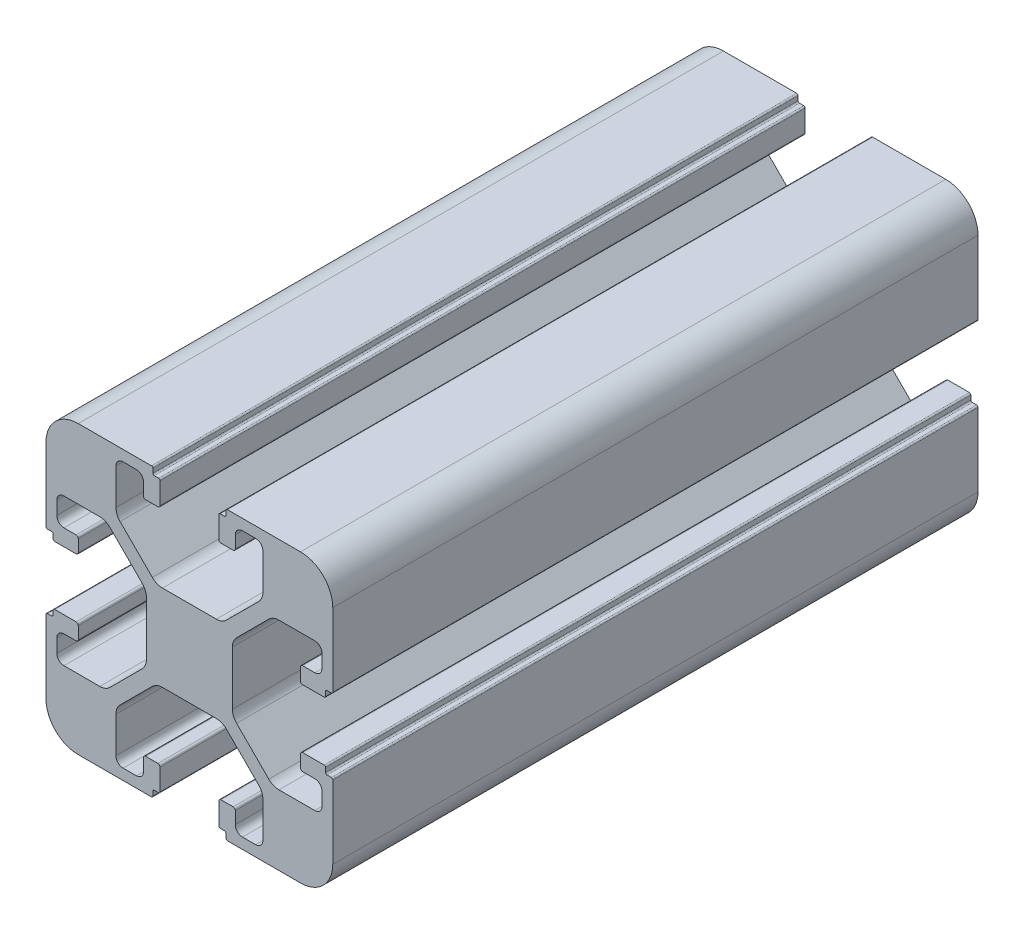
from build123d import *

# Parameters (mm, degrees)
SKETCH2_R           = 3.4
BOSS_EXTRUDE1_DEPTH = 50
BOSS_EXTRUDE2_DEPTH = 40


with BuildPart() as part:
    # Sketch2 → Boss-Extrude1 (new body)
    with BuildSketch(Plane.XY):
        with BuildLine():
            Line((4.5, 0), (14.7, 0))
            ThreePointArc((14.7, 0), (14.841421356, 0.058578644), (14.9, 0.2))
            Line((14.9, 0.2), (14.9, 0.8))
            ThreePointArc((14.9, 0.8), (14.958578644, 0.941421356), (15.1, 1))
            Line((15.1, 1), (15.7, 1))
            ThreePointArc((15.7, 1), (15.841421356, 1.058578644), (15.9, 1.2))
            Line((15.9, 1.2), (15.9, 4.2))
            ThreePointArc((15.9, 4.2), (15.812132034, 4.412132034), (15.6, 4.5))
            Line((15.6, 4.5), (13.9, 4.5))
            ThreePointArc((13.9, 4.5), (13.687867966, 4.412132034), (13.6, 4.2))
            Line((13.6, 4.2), (13.6, 2.5))
            ThreePointArc((13.6, 2.5), (13.307106781, 1.792893219), (12.6, 1.5))
            Line((12.6, 1.5), (10.75, 1.5))
            ThreePointArc((10.75, 1.5), (10.042893219, 1.792893219), (9.75, 2.5))
            Line((9.75, 2.5), (9.75, 7.507359313))
            ThreePointArc((9.75, 7.507359313), (9.902240935, 8.272726178), (10.335786438, 8.921572875))
            Line((10.335786438, 8.921572875), (14.828427125, 13.414213562))
            ThreePointArc((14.828427125, 13.414213562), (15.477273822, 13.847759065), (16.242640687, 14))
            Line((16.242640687, 14), (23.757359313, 14))
            ThreePointArc((23.757359313, 14), (24.522726178, 13.847759065), (25.171572875, 13.414213562))
            Line((25.171572875, 13.414213562), (29.664213562, 8.921572875))
            ThreePointArc((29.664213562, 8.921572875), (30.097759065, 8.272726178), (30.25, 7.507359313))
            Line((30.25, 7.507359313), (30.25, 2.5))
            ThreePointArc((30.25, 2.5), (29.957106781, 1.792893219), (29.25, 1.5))
            Line((29.25, 1.5), (27.4, 1.5))
            ThreePointArc((27.4, 1.5), (26.692893219, 1.792893219), (26.4, 2.5))
            Line((26.4, 2.5), (26.4, 4.2))
            ThreePointArc((26.4, 4.2), (26.312132034, 4.412132034), (26.1, 4.5))
            Line((26.1, 4.5), (24.4, 4.5))
            ThreePointArc((24.4, 4.5), (24.187867966, 4.412132034), (24.1, 4.2))
            Line((24.1, 4.2), (24.1, 1.2))
            ThreePointArc((24.1, 1.2), (24.158578644, 1.058578644), (24.3, 1))
            Line((24.3, 1), (24.9, 1))
            ThreePointArc((24.9, 1), (25.041421356, 0.941421356), (25.1, 0.8))
            Line((25.1, 0.8), (25.1, 0.2))
            ThreePointArc((25.1, 0.2), (25.158578644, 0.058578644), (25.3, 0))
            Line((25.3, 0), (35.5, 0))
            ThreePointArc((35.5, 0), (38.681980515, 1.318019485), (40, 4.5))
            Line((40, 4.5), (40, 14.7))
            ThreePointArc((40, 14.7), (39.941421356, 14.841421356), (39.8, 14.9))
            Line((39.8, 14.9), (39.2, 14.9))
            ThreePointArc((39.2, 14.9), (39.058578644, 14.958578644), (39, 15.1))
            Line((39, 15.1), (39, 15.7))
            ThreePointArc((39, 15.7), (38.941421356, 15.841421356), (38.8, 15.9))
            Line((38.8, 15.9), (35.8, 15.9))
            ThreePointArc((35.8, 15.9), (35.587867966, 15.812132034), (35.5, 15.6))
            Line((35.5, 15.6), (35.5, 13.9))
            ThreePointArc((35.5, 13.9), (35.587867966, 13.687867966), (35.8, 13.6))
            Line((35.8, 13.6), (37.5, 13.6))
            ThreePointArc((37.5, 13.6), (38.207106781, 13.307106781), (38.5, 12.6))
            Line((38.5, 12.6), (38.5, 10.75))
            ThreePointArc((38.5, 10.75), (38.207106781, 10.042893219), (37.5, 9.75))
            Line((37.5, 9.75), (32.492640687, 9.75))
            ThreePointArc((32.492640687, 9.75), (31.727273822, 9.902240935), (31.078427125, 10.335786438))
            Line((31.078427125, 10.335786438), (26.585786438, 14.828427125))
            ThreePointArc((26.585786438, 14.828427125), (26.152240935, 15.477273822), (26, 16.242640687))
            Line((26, 16.242640687), (26, 23.757359313))
            ThreePointArc((26, 23.757359313), (26.152240935, 24.522726178), (26.585786438, 25.171572875))
            Line((26.585786438, 25.171572875), (31.078427125, 29.664213562))
            ThreePointArc((31.078427125, 29.664213562), (31.727273822, 30.097759065), (32.492640687, 30.25))
            Line((32.492640687, 30.25), (37.5, 30.25))
            ThreePointArc((37.5, 30.25), (38.207106781, 29.957106781), (38.5, 29.25))
            Line((38.5, 29.25), (38.5, 27.4))
            ThreePointArc((38.5, 27.4), (38.207106781, 26.692893219), (37.5, 26.4))
            Line((37.5, 26.4), (35.8, 26.4))
            ThreePointArc((35.8, 26.4), (35.587867966, 26.312132034), (35.5, 26.1))
            Line((35.5, 26.1), (35.5, 24.4))
            ThreePointArc((35.5, 24.4), (35.587867966, 24.187867966), (35.8, 24.1))
            Line((35.8, 24.1), (38.8, 24.1))
            ThreePointArc((38.8, 24.1), (38.941421356, 24.158578644), (39, 24.3))
            Line((39, 24.3), (39, 24.9))
            ThreePointArc((39, 24.9), (39.058578644, 25.041421356), (39.2, 25.1))
            Line((39.2, 25.1), (39.8, 25.1))
            ThreePointArc((39.8, 25.1), (39.941421356, 25.158578644), (40, 25.3))
            Line((40, 25.3), (40, 35.5))
            ThreePointArc((40, 35.5), (38.681980515, 38.681980515), (35.5, 40))
            Line((35.5, 40), (25.3, 40))
            ThreePointArc((25.3, 40), (25.158578644, 39.941421356), (25.1, 39.8))
            Line((25.1, 39.8), (25.1, 39.2))
            ThreePointArc((25.1, 39.2), (25.041421356, 39.058578644), (24.9, 39))
            Line((24.9, 39), (24.3, 39))
            ThreePointArc((24.3, 39), (24.158578644, 38.941421356), (24.1, 38.8))
            Line((24.1, 38.8), (24.1, 35.8))
            ThreePointArc((24.1, 35.8), (24.187867966, 35.587867966), (24.4, 35.5))
            Line((24.4, 35.5), (26.1, 35.5))
            ThreePointArc((26.1, 35.5), (26.312132034, 35.587867966), (26.4, 35.8))
            Line((26.4, 35.8), (26.4, 37.5))
            ThreePointArc((26.4, 37.5), (26.692893219, 38.207106781), (27.4, 38.5))
            Line((27.4, 38.5), (29.25, 38.5))
            ThreePointArc((29.25, 38.5), (29.957106781, 38.207106781), (30.25, 37.5))
            Line((30.25, 37.5), (30.25, 32.492640687))
            ThreePointArc((30.25, 32.492640687), (30.097759065, 31.727273822), (29.664213562, 31.078427125))
            Line((29.664213562, 31.078427125), (25.171572875, 26.585786438))
            ThreePointArc((25.171572875, 26.585786438), (24.522726178, 26.152240935), (23.757359313, 26))
            Line((23.757359313, 26), (16.242640687, 26))
            ThreePointArc((16.242640687, 26), (15.477273822, 26.152240935), (14.828427125, 26.585786438))
            Line((14.828427125, 26.585786438), (10.335786438, 31.078427125))
            ThreePointArc((10.335786438, 31.078427125), (9.902240935, 31.727273822), (9.75, 32.492640687))
            Line((9.75, 32.492640687), (9.75, 37.5))
            ThreePointArc((9.75, 37.5), (10.042893219, 38.207106781), (10.75, 38.5))
            Line((10.75, 38.5), (12.6, 38.5))
            ThreePointArc((12.6, 38.5), (13.307106781, 38.207106781), (13.6, 37.5))
            Line((13.6, 37.5), (13.6, 35.8))
            ThreePointArc((13.6, 35.8), (13.687867966, 35.587867966), (13.9, 35.5))
            Line((13.9, 35.5), (15.6, 35.5))
            ThreePointArc((15.6, 35.5), (15.812132034, 35.587867966), (15.9, 35.8))
            Line((15.9, 35.8), (15.9, 38.8))
            ThreePointArc((15.9, 38.8), (15.841421356, 38.941421356), (15.7, 39))
            Line((15.7, 39), (15.1, 39))
            ThreePointArc((15.1, 39), (14.958578644, 39.058578644), (14.9, 39.2))
            Line((14.9, 39.2), (14.9, 39.8))
            ThreePointArc((14.9, 39.8), (14.841421356, 39.941421356), (14.7, 40))
            Line((14.7, 40), (4.5, 40))
            ThreePointArc((4.5, 40), (1.318019485, 38.681980515), (0, 35.5))
            Line((0, 35.5), (0, 25.3))
            ThreePointArc((0, 25.3), (0.058578644, 25.158578644), (0.2, 25.1))
            Line((0.2, 25.1), (0.8, 25.1))
            ThreePointArc((0.8, 25.1), (0.941421356, 25.041421356), (1, 24.9))
            Line((1, 24.9), (1, 24.3))
            ThreePointArc((1, 24.3), (1.058578644, 24.158578644), (1.2, 24.1))
            Line((1.2, 24.1), (4.2, 24.1))
            ThreePointArc((4.2, 24.1), (4.412132034, 24.187867966), (4.5, 24.4))
            Line((4.5, 24.4), (4.5, 26.1))
            ThreePointArc((4.5, 26.1), (4.412132034, 26.312132034), (4.2, 26.4))
            Line((4.2, 26.4), (2.5, 26.4))
            ThreePointArc((2.5, 26.4), (1.792893219, 26.692893219), (1.5, 27.4))
            Line((1.5, 27.4), (1.5, 29.25))
            ThreePointArc((1.5, 29.25), (1.792893219, 29.957106781), (2.5, 30.25))
            Line((2.5, 30.25), (7.507359313, 30.25))
            ThreePointArc((7.507359313, 30.25), (8.272726178, 30.097759065), (8.921572875, 29.664213562))
            Line((8.921572875, 29.664213562), (13.414213562, 25.171572875))
            ThreePointArc((13.414213562, 25.171572875), (13.847759065, 24.522726178), (14, 23.757359313))
            Line((14, 23.757359313), (14, 16.242640687))
            ThreePointArc((14, 16.242640687), (13.847759065, 15.477273822), (13.414213562, 14.828427125))
            Line((13.414213562, 14.828427125), (8.921572875, 10.335786438))
            ThreePointArc((8.921572875, 10.335786438), (8.272726178, 9.902240935), (7.507359313, 9.75))
            Line((7.507359313, 9.75), (2.5, 9.75))
            ThreePointArc((2.5, 9.75), (1.792893219, 10.042893219), (1.5, 10.75))
            Line((1.5, 10.75), (1.5, 12.6))
            ThreePointArc((1.5, 12.6), (1.792893219, 13.307106781), (2.5, 13.6))
            Line((2.5, 13.6), (4.2, 13.6))
            ThreePointArc((4.2, 13.6), (4.412132034, 13.687867966), (4.5, 13.9))
            Line((4.5, 13.9), (4.5, 15.6))
            ThreePointArc((4.5, 15.6), (4.412132034, 15.812132034), (4.2, 15.9))
            Line((4.2, 15.9), (1.2, 15.9))
            ThreePointArc((1.2, 15.9), (1.058578644, 15.841421356), (1, 15.7))
            Line((1, 15.7), (1, 15.1))
            ThreePointArc((1, 15.1), (0.941421356, 14.958578644), (0.8, 14.9))
            Line((0.8, 14.9), (0.2, 14.9))
            ThreePointArc((0.2, 14.9), (0.058578644, 14.841421356), (0, 14.7))
            Line((0, 14.7), (0, 4.5))
            ThreePointArc((0, 4.5), (1.318019485, 1.318019485), (4.5, 0))
        make_face()
        with Locations((20, 20)):
            Circle(SKETCH2_R, mode=Mode.SUBTRACT)
        with BuildLine():
            Line((31.55, 37.7), (31.55, 32.55))
            ThreePointArc((31.55, 32.55), (31.842893219, 31.842893219), (32.55, 31.55))
            Line((32.55, 31.55), (37.7, 31.55))
            ThreePointArc((37.7, 31.55), (38.407106781, 31.842893219), (38.7, 32.55))
            Line((38.7, 32.55), (38.7, 35.5))
            ThreePointArc((38.7, 35.5), (37.7627417, 37.7627417), (35.5, 38.7))
            Line((35.5, 38.7), (32.55, 38.7))
            ThreePointArc((32.55, 38.7), (31.842893219, 38.407106781), (31.55, 37.7))
        make_face(mode=Mode.SUBTRACT)
        with BuildLine():
            Line((1.3, 35.5), (1.3, 32.55))
            ThreePointArc((1.3, 32.55), (1.592893219, 31.842893219), (2.3, 31.55))
            Line((2.3, 31.55), (7.45, 31.55))
            ThreePointArc((7.45, 31.55), (8.157106781, 31.842893219), (8.45, 32.55))
            Line((8.45, 32.55), (8.45, 37.7))
            ThreePointArc((8.45, 37.7), (8.157106781, 38.407106781), (7.45, 38.7))
            Line((7.45, 38.7), (4.5, 38.7))
            ThreePointArc((4.5, 38.7), (2.2372583, 37.7627417), (1.3, 35.5))
        make_face(mode=Mode.SUBTRACT)
        with BuildLine():
            Line((1.3, 7.45), (1.3, 4.5))
            ThreePointArc((1.3, 4.5), (2.2372583, 2.2372583), (4.5, 1.3))
            Line((4.5, 1.3), (7.45, 1.3))
            ThreePointArc((7.45, 1.3), (8.157106781, 1.592893219), (8.45, 2.3))
            Line((8.45, 2.3), (8.45, 7.45))
            ThreePointArc((8.45, 7.45), (8.157106781, 8.157106781), (7.45, 8.45))
            Line((7.45, 8.45), (2.3, 8.45))
            ThreePointArc((2.3, 8.45), (1.592893219, 8.157106781), (1.3, 7.45))
        make_face(mode=Mode.SUBTRACT)
        with BuildLine():
            Line((31.55, 7.45), (31.55, 2.3))
            ThreePointArc((31.55, 2.3), (31.842893219, 1.592893219), (32.55, 1.3))
            Line((32.55, 1.3), (35.5, 1.3))
            ThreePointArc((35.5, 1.3), (37.7627417, 2.2372583), (38.7, 4.5))
            Line((38.7, 4.5), (38.7, 7.45))
            ThreePointArc((38.7, 7.45), (38.407106781, 8.157106781), (37.7, 8.45))
            Line((37.7, 8.45), (32.55, 8.45))
            ThreePointArc((32.55, 8.45), (31.842893219, 8.157106781), (31.55, 7.45))
        make_face(mode=Mode.SUBTRACT)
    extrude(amount=BOSS_EXTRUDE1_DEPTH)

    # Sketch3 → Boss-Extrude2 (add)
    with BuildSketch(Plane.XY.offset(50)):
        with BuildLine():
            Line((25.3, 0), (35.5, 0))
            ThreePointArc((35.5, 0), (38.681980515, 1.318019485), (40, 4.5))
            Line((40, 4.5), (40, 14.7))
            ThreePointArc((40, 14.7), (39.941421356, 14.841421356), (39.8, 14.9))
            Line((39.8, 14.9), (39.2, 14.9))
            ThreePointArc((39.2, 14.9), (39.058578644, 14.958578644), (39, 15.1))
            Line((39, 15.1), (39, 15.7))
            ThreePointArc((39, 15.7), (38.941421356, 15.841421356), (38.8, 15.9))
            Line((38.8, 15.9), (35.8, 15.9))
            ThreePointArc((35.8, 15.9), (35.587867966, 15.812132034), (35.5, 15.6))
            Line((35.5, 15.6), (35.5, 13.9))
            ThreePointArc((35.5, 13.9), (35.587867966, 13.687867966), (35.8, 13.6))
            Line((35.8, 13.6), (37.5, 13.6))
            ThreePointArc((37.5, 13.6), (38.207106781, 13.307106781), (38.5, 12.6))
            Line((38.5, 12.6), (38.5, 10.75))
            ThreePointArc((38.5, 10.75), (38.207106781, 10.042893219), (37.5, 9.75))
            Line((37.5, 9.75), (32.492640687, 9.75))
            ThreePointArc((32.492640687, 9.75), (31.727273822, 9.902240935), (31.078427125, 10.335786438))
            Line((31.078427125, 10.335786438), (26.585786438, 14.828427125))
            ThreePointArc((26.585786438, 14.828427125), (26.152240935, 15.477273822), (26, 16.242640687))
            Line((26, 16.242640687), (26, 23.757359313))
            ThreePointArc((26, 23.757359313), (26.152240935, 24.522726178), (26.585786438, 25.171572875))
            Line((26.585786438, 25.171572875), (31.078427125, 29.664213562))
            ThreePointArc((31.078427125, 29.664213562), (31.727273822, 30.097759065), (32.492640687, 30.25))
            Line((32.492640687, 30.25), (37.5, 30.25))
            ThreePointArc((37.5, 30.25), (38.207106781, 29.957106781), (38.5, 29.25))
            Line((38.5, 29.25), (38.5, 27.4))
            ThreePointArc((38.5, 27.4), (38.207106781, 26.692893219), (37.5, 26.4))
            Line((37.5, 26.4), (35.8, 26.4))
            ThreePointArc((35.8, 26.4), (35.587867966, 26.312132034), (35.5, 26.1))
            Line((35.5, 26.1), (35.5, 24.4))
            ThreePointArc((35.5, 24.4), (35.587867966, 24.187867966), (35.8, 24.1))
            Line((35.8, 24.1), (38.8, 24.1))
            ThreePointArc((38.8, 24.1), (38.941421356, 24.158578644), (39, 24.3))
            Line((39, 24.3), (39, 24.9))
            ThreePointArc((39, 24.9), (39.058578644, 25.041421356), (39.2, 25.1))
            Line((39.2, 25.1), (39.8, 25.1))
            ThreePointArc((39.8, 25.1), (39.941421356, 25.158578644), (40, 25.3))
            Line((40, 25.3), (40, 35.5))
            ThreePointArc((40, 35.5), (38.681980515, 38.681980515), (35.5, 40))
            Line((35.5, 40), (25.3, 40))
            ThreePointArc((25.3, 40), (25.158578644, 39.941421356), (25.1, 39.8))
            Line((25.1, 39.8), (25.1, 39.2))
            ThreePointArc((25.1, 39.2), (25.041421356, 39.058578644), (24.9, 39))
            Line((24.9, 39), (24.3, 39))
            ThreePointArc((24.3, 39), (24.158578644, 38.941421356), (24.1, 38.8))
            Line((24.1, 38.8), (24.1, 35.8))
            ThreePointArc((24.1, 35.8), (24.187867966, 35.587867966), (24.4, 35.5))
            Line((24.4, 35.5), (26.1, 35.5))
            ThreePointArc((26.1, 35.5), (26.312132034, 35.587867966), (26.4, 35.8))
            Line((26.4, 35.8), (26.4, 37.5))
            ThreePointArc((26.4, 37.5), (26.692893219, 38.207106781), (27.4, 38.5))
            Line((27.4, 38.5), (29.25, 38.5))
            ThreePointArc((29.25, 38.5), (29.957106781, 38.207106781), (30.25, 37.5))
            Line((30.25, 37.5), (30.25, 32.492640687))
            ThreePointArc((30.25, 32.492640687), (30.097759065, 31.727273822), (29.664213562, 31.078427125))
            Line((29.664213562, 31.078427125), (25.171572875, 26.585786438))
            ThreePointArc((25.171572875, 26.585786438), (24.522726178, 26.152240935), (23.757359313, 26))
            Line((23.757359313, 26), (16.242640687, 26))
            ThreePointArc((16.242640687, 26), (15.477273822, 26.152240935), (14.828427125, 26.585786438))
            Line((14.828427125, 26.585786438), (10.335786438, 31.078427125))
            ThreePointArc((10.335786438, 31.078427125), (9.902240935, 31.727273822), (9.75, 32.492640687))
            Line((9.75, 32.492640687), (9.75, 37.5))
            ThreePointArc((9.75, 37.5), (10.042893219, 38.207106781), (10.75, 38.5))
            Line((10.75, 38.5), (12.6, 38.5))
            ThreePointArc((12.6, 38.5), (13.307106781, 38.207106781), (13.6, 37.5))
            Line((13.6, 37.5), (13.6, 35.8))
            ThreePointArc((13.6, 35.8), (13.687867966, 35.587867966), (13.9, 35.5))
            Line((13.9, 35.5), (15.6, 35.5))
            ThreePointArc((15.6, 35.5), (15.812132034, 35.587867966), (15.9, 35.8))
            Line((15.9, 35.8), (15.9, 38.8))
            ThreePointArc((15.9, 38.8), (15.841421356, 38.941421356), (15.7, 39))
            Line((15.7, 39), (15.1, 39))
            ThreePointArc((15.1, 39), (14.958578644, 39.058578644), (14.9, 39.2))
            Line((14.9, 39.2), (14.9, 39.8))
            ThreePointArc((14.9, 39.8), (14.841421356, 39.941421356), (14.7, 40))
            Line((14.7, 40), (4.5, 40))
            ThreePointArc((4.5, 40), (1.318019485, 38.681980515), (0, 35.5))
            Line((0, 35.5), (0, 25.3))
            ThreePointArc((0, 25.3), (0.058578644, 25.158578644), (0.2, 25.1))
            Line((0.2, 25.1), (0.8, 25.1))
            ThreePointArc((0.8, 25.1), (0.941421356, 25.041421356), (1, 24.9))
            Line((1, 24.9), (1, 24.3))
            ThreePointArc((1, 24.3), (1.058578644, 24.158578644), (1.2, 24.1))
            Line((1.2, 24.1), (4.2, 24.1))
            ThreePointArc((4.2, 24.1), (4.412132034, 24.187867966), (4.5, 24.4))
            Line((4.5, 24.4), (4.5, 26.1))
            ThreePointArc((4.5, 26.1), (4.412132034, 26.312132034), (4.2, 26.4))
            Line((4.2, 26.4), (2.5, 26.4))
            ThreePointArc((2.5, 26.4), (1.792893219, 26.692893219), (1.5, 27.4))
            Line((1.5, 27.4), (1.5, 29.25))
            ThreePointArc((1.5, 29.25), (1.792893219, 29.957106781), (2.5, 30.25))
            Line((2.5, 30.25), (7.507359313, 30.25))
            ThreePointArc((7.507359313, 30.25), (8.272726178, 30.097759065), (8.921572875, 29.664213562))
            Line((8.921572875, 29.664213562), (13.414213562, 25.171572875))
            ThreePointArc((13.414213562, 25.171572875), (13.847759065, 24.522726178), (14, 23.757359313))
            Line((14, 23.757359313), (14, 16.242640687))
            ThreePointArc((14, 16.242640687), (13.847759065, 15.477273822), (13.414213562, 14.828427125))
            Line((13.414213562, 14.828427125), (8.921572875, 10.335786438))
            ThreePointArc((8.921572875, 10.335786438), (8.272726178, 9.902240935), (7.507359313, 9.75))
            Line((7.507359313, 9.75), (2.5, 9.75))
            ThreePointArc((2.5, 9.75), (1.792893219, 10.042893219), (1.5, 10.75))
            Line((1.5, 10.75), (1.5, 12.6))
            ThreePointArc((1.5, 12.6), (1.792893219, 13.307106781), (2.5, 13.6))
            Line((2.5, 13.6), (4.2, 13.6))
            ThreePointArc((4.2, 13.6), (4.412132034, 13.687867966), (4.5, 13.9))
            Line((4.5, 13.9), (4.5, 15.6))
            ThreePointArc((4.5, 15.6), (4.412132034, 15.812132034), (4.2, 15.9))
            Line((4.2, 15.9), (1.2, 15.9))
            ThreePointArc((1.2, 15.9), (1.058578644, 15.841421356), (1, 15.7))
            Line((1, 15.7), (1, 15.1))
            ThreePointArc((1, 15.1), (0.941421356, 14.958578644), (0.8, 14.9))
            Line((0.8, 14.9), (0.2, 14.9))
            ThreePointArc((0.2, 14.9), (0.058578644, 14.841421356), (0, 14.7))
            Line((0, 14.7), (0, 4.5))
            ThreePointArc((0, 4.5), (1.318019485, 1.318019485), (4.5, 0))
            Line((4.5, 0), (14.7, 0))
            ThreePointArc((14.7, 0), (14.841421356, 0.058578644), (14.9, 0.2))
            Line((14.9, 0.2), (14.9, 0.8))
            ThreePointArc((14.9, 0.8), (14.958578644, 0.941421356), (15.1, 1))
            Line((15.1, 1), (15.7, 1))
            ThreePointArc((15.7, 1), (15.841421356, 1.058578644), (15.9, 1.2))
            Line((15.9, 1.2), (15.9, 4.2))
            ThreePointArc((15.9, 4.2), (15.812132034, 4.412132034), (15.6, 4.5))
            Line((15.6, 4.5), (13.9, 4.5))
            ThreePointArc((13.9, 4.5), (13.687867966, 4.412132034), (13.6, 4.2))
            Line((13.6, 4.2), (13.6, 2.5))
            ThreePointArc((13.6, 2.5), (13.307106781, 1.792893219), (12.6, 1.5))
            Line((12.6, 1.5), (10.75, 1.5))
            ThreePointArc((10.75, 1.5), (10.042893219, 1.792893219), (9.75, 2.5))
            Line((9.75, 2.5), (9.75, 7.507359313))
            ThreePointArc((9.75, 7.507359313), (9.902240935, 8.272726178), (10.335786438, 8.921572875))
            Line((10.335786438, 8.921572875), (14.828427125, 13.414213562))
            ThreePointArc((14.828427125, 13.414213562), (15.477273822, 13.847759065), (16.242640687, 14))
            Line((16.242640687, 14), (23.757359313, 14))
            ThreePointArc((23.757359313, 14), (24.522726178, 13.847759065), (25.171572875, 13.414213562))
            Line((25.171572875, 13.414213562), (29.664213562, 8.921572875))
            ThreePointArc((29.664213562, 8.921572875), (30.097759065, 8.272726178), (30.25, 7.507359313))
            Line((30.25, 7.507359313), (30.25, 2.5))
            ThreePointArc((30.25, 2.5), (29.957106781, 1.792893219), (29.25, 1.5))
            Line((29.25, 1.5), (27.4, 1.5))
            ThreePointArc((27.4, 1.5), (26.692893219, 1.792893219), (26.4, 2.5))
            Line((26.4, 2.5), (26.4, 4.2))
            ThreePointArc((26.4, 4.2), (26.312132034, 4.412132034), (26.1, 4.5))
            Line((26.1, 4.5), (24.4, 4.5))
            ThreePointArc((24.4, 4.5), (24.187867966, 4.412132034), (24.1, 4.2))
            Line((24.1, 4.2), (24.1, 1.2))
            ThreePointArc((24.1, 1.2), (24.158578644, 1.058578644), (24.3, 1))
            Line((24.3, 1), (24.9, 1))
            ThreePointArc((24.9, 1), (25.041421356, 0.941421356), (25.1, 0.8))
            Line((25.1, 0.8), (25.1, 0.2))
            ThreePointArc((25.1, 0.2), (25.158578644, 0.058578644), (25.3, 0))
        make_face()
    extrude(amount=BOSS_EXTRUDE2_DEPTH)


solid = part.part
